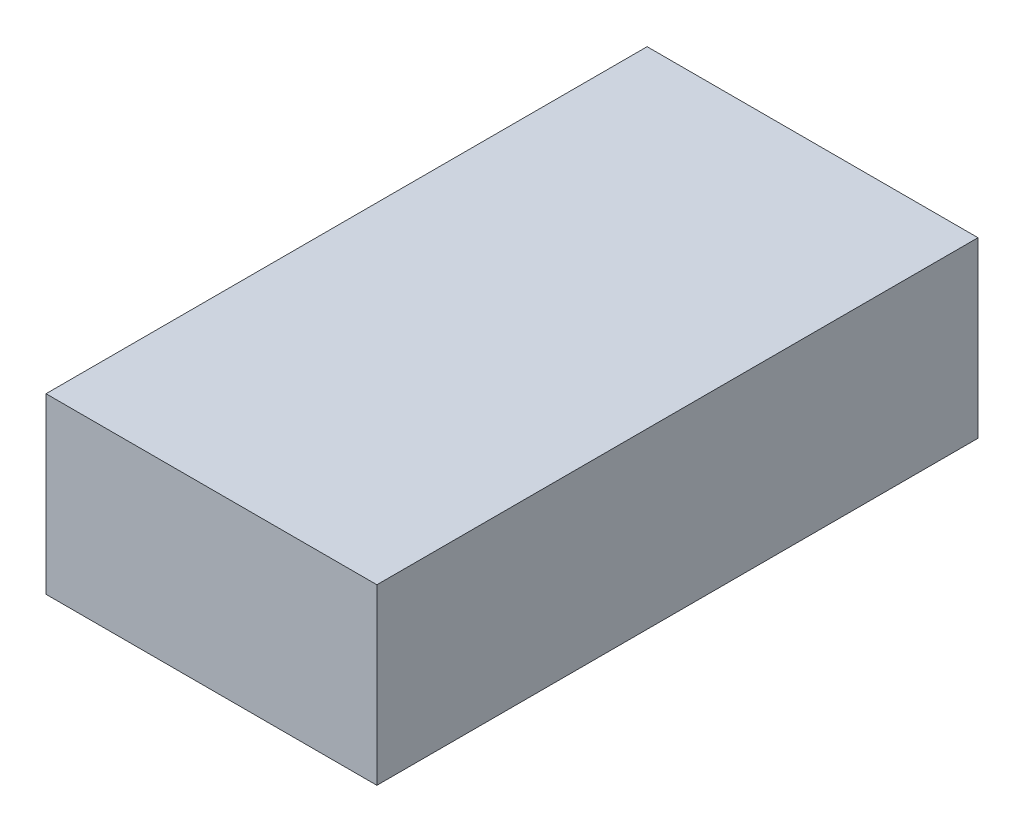
from build123d import *

# Parameters (mm, degrees)
SKETCH_1_W      = 120
SKETCH_1_H      = 218
EXTRUDE_1_DEPTH = 63


with BuildPart() as part:
    # 草图1 → 凸台-拉伸1 (new body)
    with BuildSketch(Plane(origin=(0, 0, 0), x_dir=(1, 0, 0), z_dir=(0, 1, 0))):
        Rectangle(SKETCH_1_W, SKETCH_1_H)
    extrude(amount=EXTRUDE_1_DEPTH)


solid = part.part
